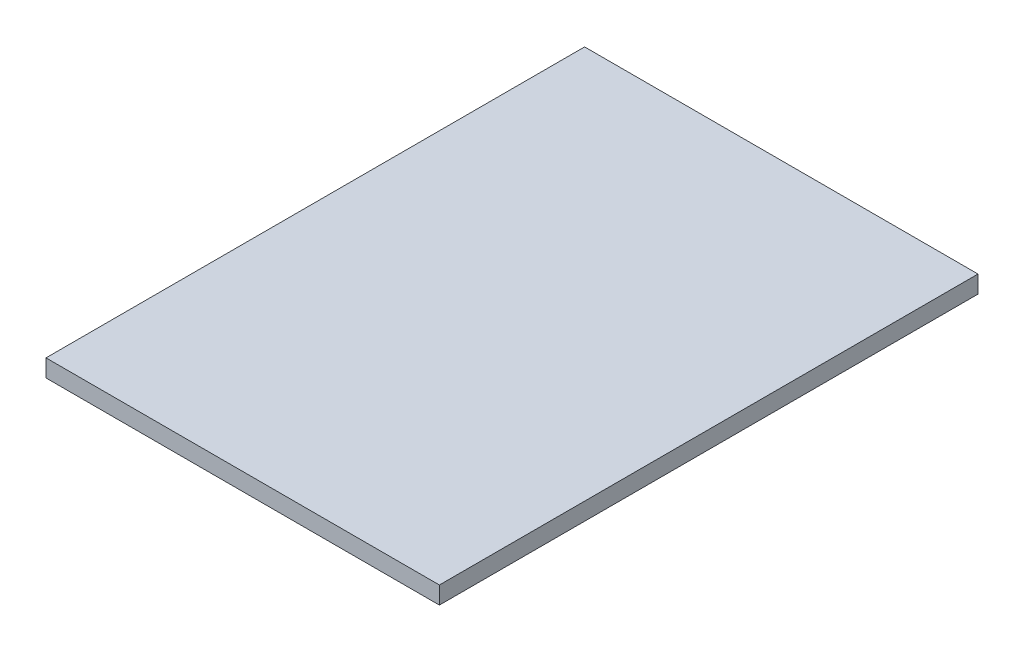
from build123d import *

# Parameters (mm, degrees)
SKETCH1_W           = 679.45
SKETCH1_H           = 930.275
BOSS_EXTRUDE1_DEPTH = 30.099
SKETCH2_W           = 667.258
SKETCH2_H           = 918.083
CUT_EXTRUDE1_DEPTH  = 23.876
SKETCH3_W           = 679.45
SKETCH3_H           = 930.275
SKETCH3_W_2         = 629.666
SKETCH3_H_2         = 880.491
BOSS_EXTRUDE2_DEPTH = 0.889
SKETCH4_W           = 114.3
SKETCH4_H           = 76.2
BOSS_EXTRUDE3_DEPTH = 12.7


with BuildPart() as part:
    # Sketch1 → Boss-Extrude1 (new body)
    with BuildSketch(Plane(origin=(0, 0, 0), x_dir=(1, 0, 0), z_dir=(0, 1, 0))):
        with Locations((339.725, 465.1375)):
            Rectangle(SKETCH1_W, SKETCH1_H)
    extrude(amount=BOSS_EXTRUDE1_DEPTH)

    # Sketch2 → Cut-Extrude1 (cut)
    with BuildSketch(Plane.XZ):
        with Locations((339.725, -465.1375)):
            Rectangle(SKETCH2_W, SKETCH2_H)
    extrude(amount=-CUT_EXTRUDE1_DEPTH, mode=Mode.SUBTRACT)

    # Sketch3 → Boss-Extrude2 (add)
    with BuildSketch(Plane.XZ):
        with Locations((339.725, -465.1375)):
            Rectangle(SKETCH3_W, SKETCH3_H)
        with Locations((339.725, -465.1375)):
            Rectangle(SKETCH3_W_2, SKETCH3_H_2, mode=Mode.SUBTRACT)
    extrude(amount=-BOSS_EXTRUDE2_DEPTH)

    # Sketch4 → Boss-Extrude3 (add)
    with BuildSketch(Plane.XZ.offset(-23.876)):
        with Locations((339.725, -828.675)):
            Rectangle(SKETCH4_W, SKETCH4_H)
    extrude(amount=BOSS_EXTRUDE3_DEPTH)


solid = part.part
